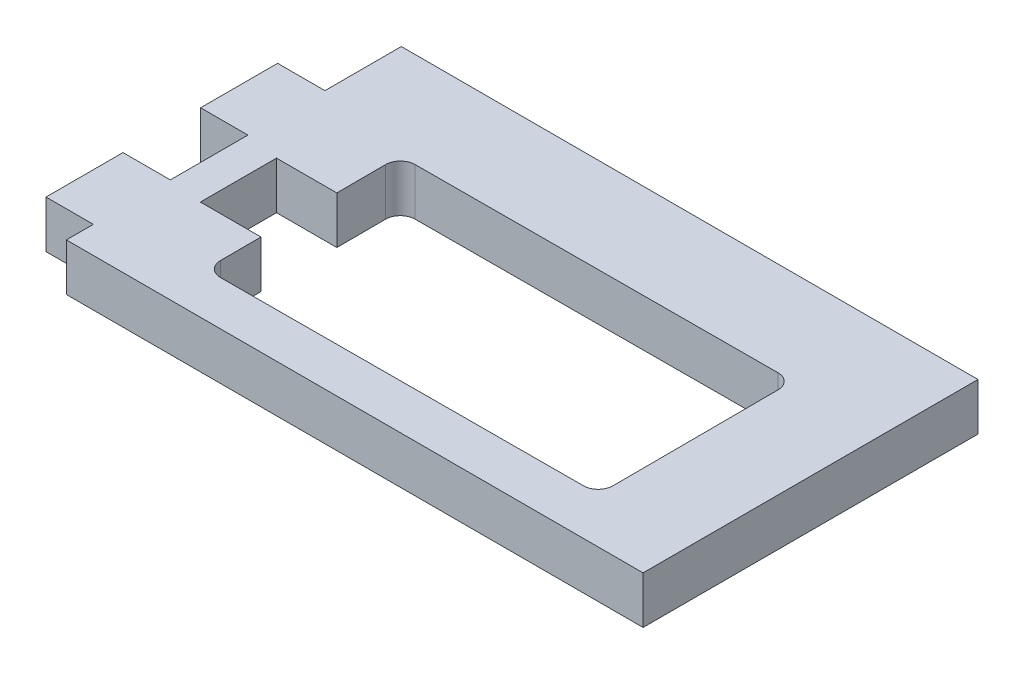
from build123d import *

# Parameters (mm, degrees)
SKETCH1_W           = 127
SKETCH1_H           = 101.6
BOSS_EXTRUDE1_DEPTH = 4.800000052
CUT_EXTRUDE1_DEPTH  = 163.710171779
SKETCH4_W           = 127
SKETCH4_H           = 101.6
SKETCH4_W_2         = 63.302571571
SKETCH4_H_2         = 39.058596
CUT_EXTRUDE3_DEPTH  = 163.710171779
SKETCH5_W           = 4.800000052
SKETCH5_H           = 7.8117192
SKETCH5_H_2         = 7.874
SKETCH5_H_3         = 7.7494384
CUT_EXTRUDE4_DEPTH  = 133.639014141
SKETCH6_W           = 6.142649692
SKETCH6_H           = 7.722699729
CUT_EXTRUDE5_DEPTH  = 133.639014141
SKETCH7_W           = 58.502571519
SKETCH7_H           = 5.08
CUT_EXTRUDE6_DEPTH  = 133.639014141


with BuildPart() as part:
    # Sketch1 → Boss-Extrude1 (new body)
    with BuildSketch(Plane(origin=(0, 0, 0), x_dir=(1, 0, 0), z_dir=(0, 1, 0))):
        with Locations((63.5, 50.8)):
            Rectangle(SKETCH1_W, SKETCH1_H)
    extrude(amount=BOSS_EXTRUDE1_DEPTH)

    # Sketch3 → Cut-Extrude1 (cut, through all)
    with BuildSketch(Plane(origin=(0, 4.800000052, 0), x_dir=(1, 0, 0), z_dir=(0, 1, 0))):
        with BuildLine():
            Line((62.069935242, 45.315244869), (98.769812683, 45.432826029))
            ThreePointArc((98.769812683, 45.432826029), (99.829038472, 45.875546579), (100.264962787, 46.93758742))
            Line((100.264962787, 46.93758742), (100.211138047, 63.737569431))
            ThreePointArc((100.211138047, 63.737569431), (99.768417497, 64.79679522), (98.706376655, 65.232719535))
            Line((98.706376655, 65.232719535), (62.006499215, 65.115138375))
            ThreePointArc((62.006499215, 65.115138375), (60.947273426, 64.672417825), (60.51134911, 63.610376984))
            Line((60.51134911, 63.610376984), (60.565173851, 46.810394973))
            ThreePointArc((60.565173851, 46.810394973), (61.007894401, 45.751169184), (62.069935242, 45.315244869))
        make_face()
    extrude(amount=-CUT_EXTRUDE1_DEPTH, mode=Mode.SUBTRACT)

    # Sketch4 → Cut-Extrude3 (cut, through all)
    with BuildSketch(Plane.XZ):
        with Locations((63.5, -50.8)):
            Rectangle(SKETCH4_W, SKETCH4_H)
        with Locations((77.789401758, -55.255753861)):
            Rectangle(SKETCH4_W_2, SKETCH4_H_2, mode=Mode.SUBTRACT)
    extrude(amount=-CUT_EXTRUDE3_DEPTH, mode=Mode.SUBTRACT)

    # Sketch5 → Cut-Extrude4 (cut, through all)
    with BuildSketch(Plane.XZ):
        with Locations((48.538115998, -39.632315461)):
            Rectangle(SKETCH5_W, SKETCH5_H)
        with Locations((48.538115998, -55.286894261)):
            Rectangle(SKETCH5_W, SKETCH5_H_2)
        with Locations((48.538115998, -70.910332661)):
            Rectangle(SKETCH5_W, SKETCH5_H_3)
    extrude(amount=-CUT_EXTRUDE4_DEPTH, mode=Mode.SUBTRACT)

    # Sketch6 → Cut-Extrude5 (cut, through all)
    with BuildSketch(Plane.XZ):
        with Locations((57.480654221, -54.790150784)):
            Rectangle(SKETCH6_W, SKETCH6_H)
    extrude(amount=-CUT_EXTRUDE5_DEPTH, mode=Mode.SUBTRACT)

    # Sketch7 → Cut-Extrude6 (cut, through all)
    with BuildSketch(Plane(origin=(0, 4.800000052, 0), x_dir=(1, 0, 0), z_dir=(0, 1, 0))):
        with Locations((80.189401784, 38.266455861)):
            Rectangle(SKETCH7_W, SKETCH7_H)
    extrude(amount=-CUT_EXTRUDE6_DEPTH, mode=Mode.SUBTRACT)


solid = part.part
